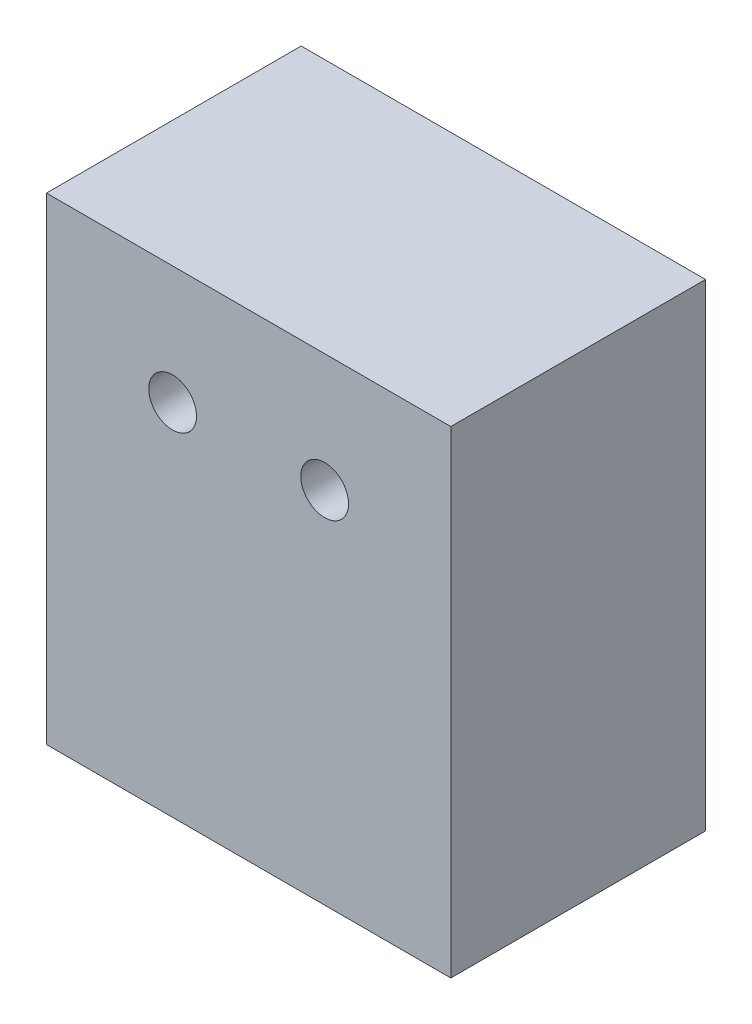
from build123d import *

# Parameters (mm, degrees)
SKETCH_1_W          = 12.7
SKETCH_1_H          = 15
EXTRUDE_1_DEPTH     = 8
SKETCH_2_R          = 0.75
CUT_EXTRUDE_1_DEPTH = 8
SKETCH_3_R          = 1.25
CUT_EXTRUDE_2_DEPTH = 5


with BuildPart() as part:
    # Эскиз1 → Бобышка-Вытянуть1 (new body)
    with BuildSketch(Plane.XY):
        Rectangle(SKETCH_1_W, SKETCH_1_H)
    extrude(amount=EXTRUDE_1_DEPTH)

    # Эскиз2 → Вырез-Вытянуть1 (cut)
    with BuildSketch(Plane.XY.offset(8)):
        with Locations((-2.3876, 3.786)):
            Circle(SKETCH_2_R)
        with Locations((2.3876, 3.79)):
            Circle(SKETCH_2_R)
    extrude(amount=-CUT_EXTRUDE_1_DEPTH, mode=Mode.SUBTRACT)

    # Эскиз3 → Вырез-Вытянуть2 (cut)
    with BuildSketch(Plane.XZ.offset(7.5)):
        with Locations(Location((-2.5, 4, 0), (0, 0, 270))):
            Circle(SKETCH_3_R)
        with Locations(Location((2.5, 4, 0), (0, 0, 270))):
            Circle(SKETCH_3_R)
    extrude(amount=-CUT_EXTRUDE_2_DEPTH, mode=Mode.SUBTRACT)


solid = part.part
